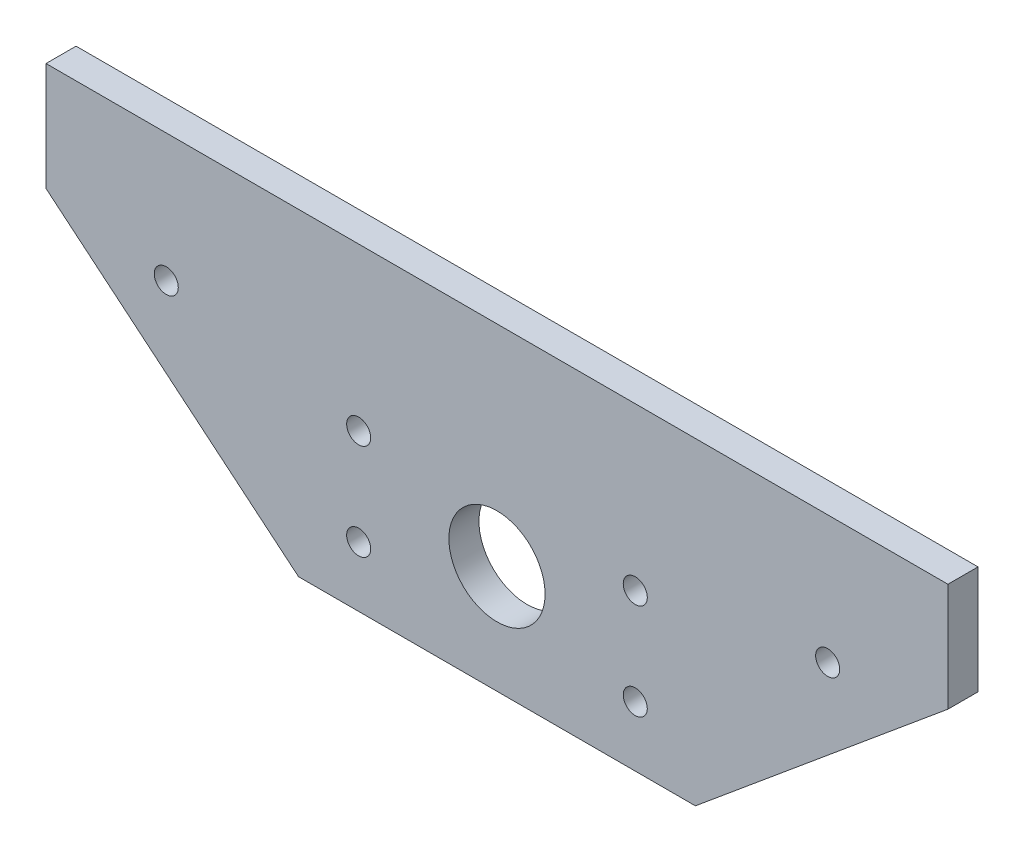
from build123d import *

# Parameters (mm, degrees)
SKETCH_1_W          = 150
SKETCH_1_H          = 70
EXTRUDE_1_DEPTH     = 5
SKETCH_2_R          = 8
CUT_EXTRUDE_1_DEPTH = 83.949769328
SKETCH_3_R          = 2
CUT_EXTRUDE_2_DEPTH = 83.949769328
SKETCH_4_R          = 2
CUT_EXTRUDE_3_DEPTH = 83.949769328
CUT_EXTRUDE_4_DEPTH = 83.949769328


with BuildPart() as part:
    # 스케치1 → 보스-돌출1 (new body)
    with BuildSketch(Plane.XY):
        with Locations((0, -0.080824272)):
            Rectangle(SKETCH_1_W, SKETCH_1_H)
    extrude(amount=EXTRUDE_1_DEPTH)

    # 스케치2 → 컷-돌출1 (cut, through all)
    with BuildSketch(Plane.XY.offset(5)):
        Circle(SKETCH_2_R)
    extrude(amount=-CUT_EXTRUDE_1_DEPTH, mode=Mode.SUBTRACT)

    # 스케치3 → 컷-돌출2 (cut, through all)
    with BuildSketch(Plane.XY.offset(5)):
        with Locations((-23, 8)):
            Circle(SKETCH_3_R)
        with Locations(Location((-23, -8, 0), (0, 0, 180))):
            Circle(SKETCH_3_R)
        with Locations((23, -8)):
            Circle(SKETCH_3_R)
        with Locations(Location((23, 8, 0), (0, 0, 180))):
            Circle(SKETCH_3_R)
    extrude(amount=-CUT_EXTRUDE_2_DEPTH, mode=Mode.SUBTRACT)

    # 스케치4 → 컷-돌출3 (cut, through all)
    with BuildSketch(Plane.XY.offset(5)):
        with Locations((-55, 13.64900919)):
            Circle(SKETCH_4_R)
        with Locations((-65, -25.080824272)):
            Circle(SKETCH_4_R)
        with Locations(Location((65, -25.080824272, 0), (0, 0, 180))):
            Circle(SKETCH_4_R)
        with Locations(Location((55, 13.64900919, 0), (0, 0, 180))):
            Circle(SKETCH_4_R)
    extrude(amount=-CUT_EXTRUDE_3_DEPTH, mode=Mode.SUBTRACT)

    # 스케치5 → 컷-돌출4 (cut, through all)
    with BuildSketch(Plane.XY.offset(5)):
        Polygon((-75, 16.919175728), (-33, -18), (33, -18), (75, 16.919175728), (75, -35.080824272), (-75, -35.080824272), (-75, -27.080824272), align=None)
    extrude(amount=-CUT_EXTRUDE_4_DEPTH, mode=Mode.SUBTRACT)


solid = part.part
